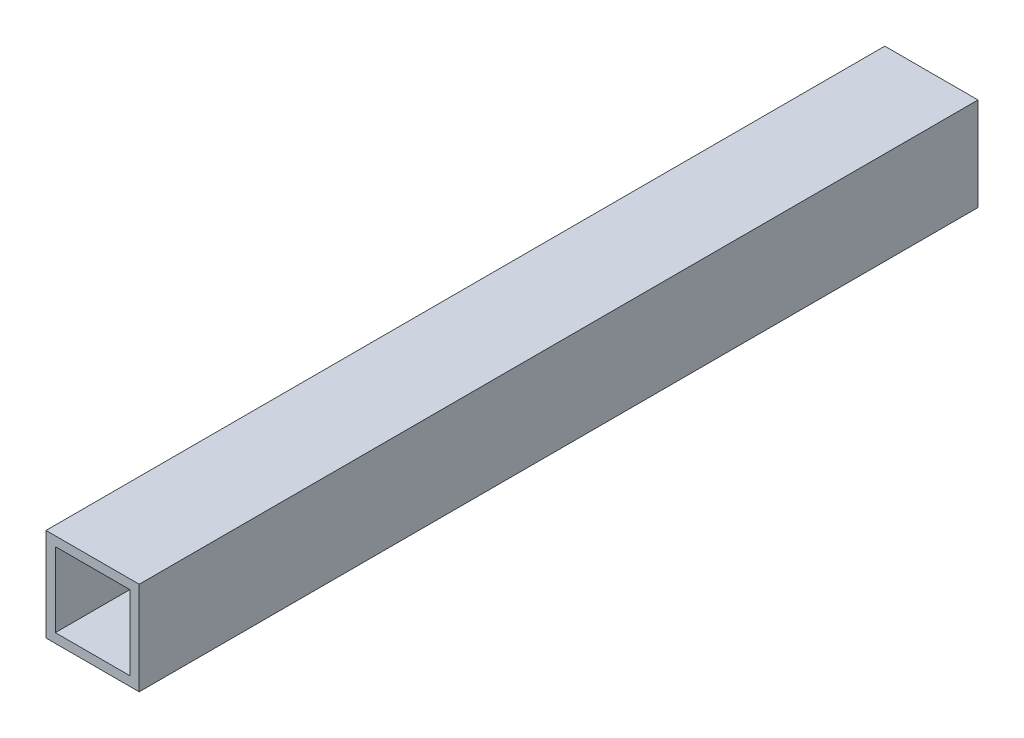
from build123d import *

# Parameters (mm, degrees)
SKETCH1_W           = 25.4
SKETCH1_H           = 25.4
SKETCH1_W_2         = 20.32
SKETCH1_H_2         = 20.32
BOSS_EXTRUDE1_DEPTH = 114.3


with BuildPart() as part:
    # Sketch1 → Boss-Extrude1 (new, symmetric)
    with BuildSketch(Plane.XY):
        Rectangle(SKETCH1_W, SKETCH1_H)
        Rectangle(SKETCH1_W_2, SKETCH1_H_2, mode=Mode.SUBTRACT)
    extrude(amount=BOSS_EXTRUDE1_DEPTH, both=True)


solid = part.part
